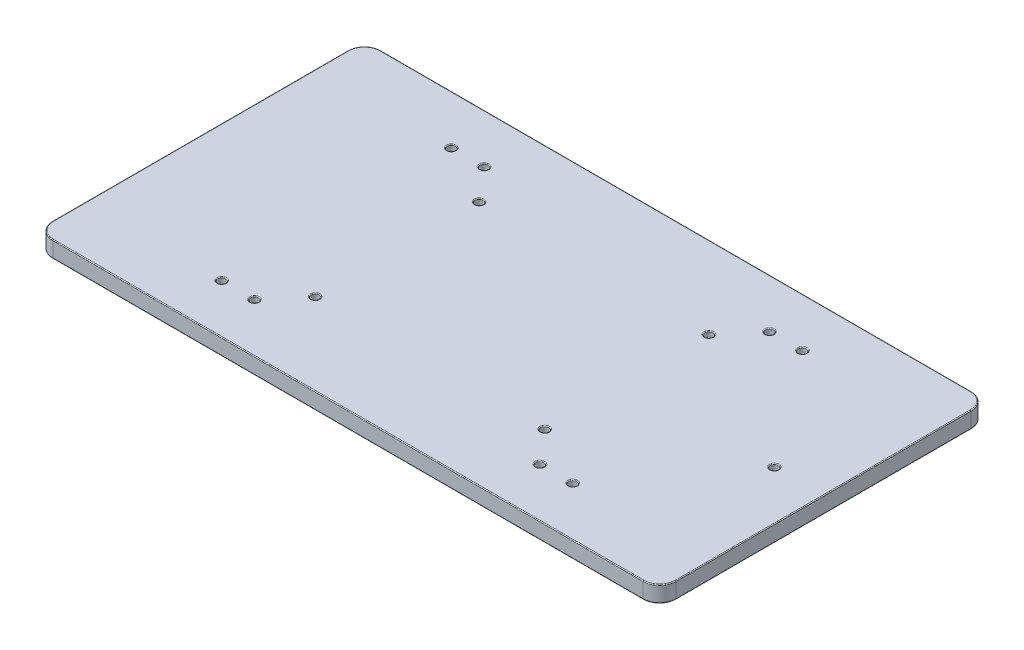
from build123d import *

# Parameters (mm, degrees)
SKETCH1_W           = 190
SKETCH1_H           = 100
SKETCH1_R           = 1.25
BOSS_EXTRUDE1_DEPTH = 5
FILLET1_R           = 5
FILLET2_R           = 0.25


with BuildPart() as part:
    # Sketch1 → Boss-Extrude1 (new body)
    with BuildSketch(Plane(origin=(0, 0, 0), x_dir=(1, 0, 0), z_dir=(0, 1, 0))):
        Rectangle(SKETCH1_W, SKETCH1_H)
        with Locations(Location((35, 25, 0), (0, 0, 270))):
            Circle(SKETCH1_R, mode=Mode.SUBTRACT)
        with Locations(Location((35, -25, 0), (0, 0, 270))):
            Circle(SKETCH1_R, mode=Mode.SUBTRACT)
        with Locations(Location((-35, -25, 0), (0, 0, 270))):
            Circle(SKETCH1_R, mode=Mode.SUBTRACT)
        with Locations(Location((-35, 25, 0), (0, 0, 270))):
            Circle(SKETCH1_R, mode=Mode.SUBTRACT)
        with Locations(Location((80, 0, 0), (0, 0, 270))):
            Circle(SKETCH1_R, mode=Mode.SUBTRACT)
        with Locations(Location((-53.5, -35, 0), (0, 0, 270))):
            Circle(SKETCH1_R, mode=Mode.SUBTRACT)
        with Locations(Location((-43.5, -35, 0), (0, 0, 270))):
            Circle(SKETCH1_R, mode=Mode.SUBTRACT)
        with Locations(Location((-43.5, 35, 0), (0, 0, 90))):
            Circle(SKETCH1_R, mode=Mode.SUBTRACT)
        with Locations(Location((-53.5, 35, 0), (0, 0, 90))):
            Circle(SKETCH1_R, mode=Mode.SUBTRACT)
        with Locations(Location((43.5, -35, 0), (0, 0, 90))):
            Circle(SKETCH1_R, mode=Mode.SUBTRACT)
        with Locations(Location((53.5, -35, 0), (0, 0, 90))):
            Circle(SKETCH1_R, mode=Mode.SUBTRACT)
        with Locations(Location((53.5, 35, 0), (0, 0, 270))):
            Circle(SKETCH1_R, mode=Mode.SUBTRACT)
        with Locations(Location((43.5, 35, 0), (0, 0, 270))):
            Circle(SKETCH1_R, mode=Mode.SUBTRACT)
    extrude(amount=BOSS_EXTRUDE1_DEPTH)

    # Fillet1
    fillet1_edges = [part.edges().sort_by_distance(p)[0] for p in [
        (95, 2.5, 50),
        (-95, 2.5, 50),
        (-95, 2.5, -50),
        (95, 2.5, -50),
    ]]
    fillet(fillet1_edges, radius=FILLET1_R)

    # Fillet2
    fillet2_edges = [part.edges().sort_by_distance(p)[0] for p in [
        (35, 0, -26.25),
        (35, 5, -26.25),
        (35, 0, 23.75),
        (35, 5, 23.75),
        (-35, 0, 23.75),
        (-35, 5, 23.75),
        (-35, 0, -26.25),
        (-35, 5, -26.25),
        (80, 0, -1.25),
        (80, 5, -1.25),
        (-53.5, 0, 33.75),
        (-53.5, 5, 33.75),
        (-43.5, 0, 33.75),
        (-43.5, 5, 33.75),
        (-43.5, 0, -33.75),
        (-43.5, 5, -33.75),
        (-53.5, 0, -33.75),
        (-53.5, 5, -33.75),
        (43.5, 0, 36.25),
        (43.5, 5, 36.25),
        (53.5, 0, 36.25),
        (53.5, 5, 36.25),
        (53.5, 0, -36.25),
        (53.5, 5, -36.25),
        (43.5, 0, -36.25),
        (43.5, 5, -36.25),
        (-95, 0, 0),
        (-95, 5, 0),
        (95, 0, 0),
        (0, 0, 50),
        (0, 0, -50),
        (93.535533906, 0, 48.535533906),
        (93.535533906, 0, -48.535533906),
        (-93.535533906, 0, 48.535533906),
        (-93.535533906, 0, -48.535533906),
        (0, 5, -50),
        (95, 5, 0),
        (0, 5, 50),
        (93.535533906, 5, 48.535533906),
        (93.535533906, 5, -48.535533906),
        (-93.535533906, 5, 48.535533906),
        (-93.535533906, 5, -48.535533906),
    ]]
    fillet(fillet2_edges, radius=FILLET2_R)


solid = part.part
